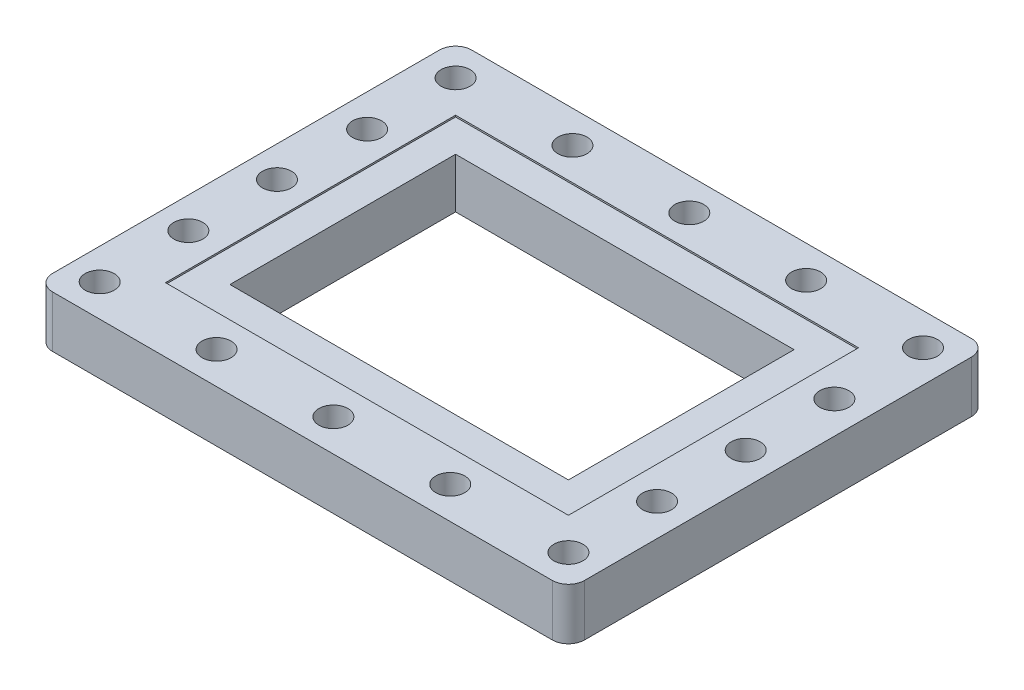
from build123d import *

# Parameters (mm, degrees)
SKETCH1_W                   = 33
SKETCH1_H                   = 26
BOSS_EXTRUDE1_DEPTH         = 3.1
SKETCH3_W                   = 4
SKETCH3_H                   = 18
BOSS_EXTRUDE2_DEPTH         = 0.1
TAP_DRILL_FOR_M2X0_4_TAP2_D = 1.8
FILLET2_R                   = 1
SKETCH11_W                  = 21
SKETCH11_H                  = 14
CUT_EXTRUDE2_DEPTH          = 25.459005547


with BuildPart() as part:
    # Sketch1 → Boss-Extrude1 (new body)
    with BuildSketch(Plane(origin=(0, 0, 0), x_dir=(1, 0, 0), z_dir=(0, 1, 0))):
        with Locations((1.816045381, -2.910858995)):
            Rectangle(SKETCH1_W, SKETCH1_H)
    extrude(amount=BOSS_EXTRUDE1_DEPTH)

    # Sketch3 → Boss-Extrude2 (add)
    with BuildSketch(Plane(origin=(0, 3.1, 0), x_dir=(1, 0, 0), z_dir=(0, 1, 0))):
        Polygon((-10.683954619, 10.089141005), (-14.683954619, 10.089141005), (-14.683954619, -15.910858995), (-10.683954619, -15.910858995), (-10.683954619, -11.910858995), (-10.683954619, 6.089141005), align=None)
        Polygon((18.316045381, 10.089141005), (-10.683954619, 10.089141005), (-10.683954619, 6.089141005), (14.316045381, 6.089141005), (18.316045381, 6.089141005), align=None)
        Polygon((-10.683954619, -11.910858995), (-10.683954619, -15.910858995), (18.316045381, -15.910858995), (18.316045381, -11.910858995), (14.316045381, -11.910858995), align=None)
        with Locations((16.316045381, -2.910858995)):
            Rectangle(SKETCH3_W, SKETCH3_H)
    extrude(amount=BOSS_EXTRUDE2_DEPTH)

    # Tap Drill for M2x0.4 Tap2 (through all)
    with Locations(Plane(origin=(0, 3.2, 0), x_dir=(1, 0, 0), z_dir=(0, 1, 0))):
        with Locations((-12.683954619, 8.089141005), (-12.674525688, 2.589141005), (-12.764705981, -2.910858995), (-12.764705981, -8.410858995), (-12.764705981, -13.910858995), (-5.433954619, 8.089141005), (1.816045381, 8.089141005), (1.735294019, -13.910858995), (-5.514705981, -13.910858995), (9.066045381, 8.089141005), (16.316045381, 8.089141005), (16.316045381, 2.589141005), (16.316045381, -2.910858995), (16.316045381, -8.410858995), (16.316045381, -13.910858995), (8.985294019, -13.910858995)):
            Hole(TAP_DRILL_FOR_M2X0_4_TAP2_D / 2)

    # Fillet2
    fillet2_edges = [part.edges().sort_by_distance(p)[0] for p in [
        (-14.683954619, 1.6, -10.089141005),
        (18.316045381, 1.6, -10.089141005),
        (18.316045381, 1.6, 15.910858995),
        (-14.683954619, 1.6, 15.910858995),
    ]]
    fillet(fillet2_edges, radius=FILLET2_R)

    # Sketch11 → Cut-Extrude2 (cut, through all)
    with BuildSketch(Plane(origin=(0, 3.1, 0), x_dir=(1, 0, 0), z_dir=(0, 1, 0))):
        with Locations((1.816045381, -2.910858995)):
            Rectangle(SKETCH11_W, SKETCH11_H)
    extrude(amount=-CUT_EXTRUDE2_DEPTH, mode=Mode.SUBTRACT)


solid = part.part
